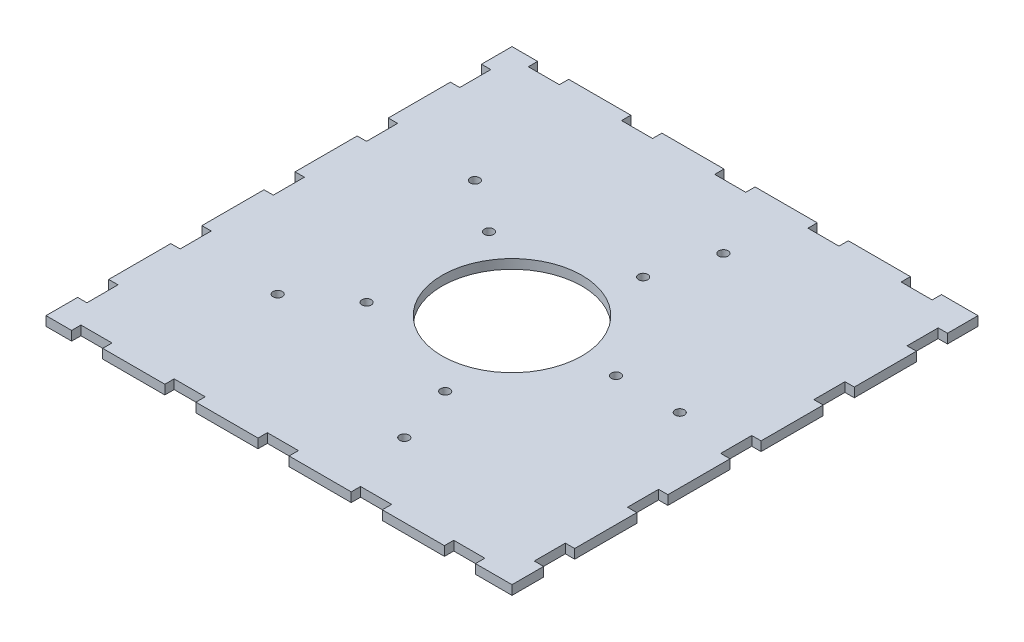
from build123d import *

# Parameters (mm, degrees)
SKETCH1_W           = 150
SKETCH1_H           = 150
BOSS_EXTRUDE1_DEPTH = 3
SKETCH2_R           = 22.5
CUT_EXTRUDE1_DEPTH  = 3
SKETCH3_W           = 10
SKETCH3_H           = 3
CUT_EXTRUDE2_DEPTH  = 3
LPATTERN1_COUNT     = 5
LPATTERN1_PITCH     = 30
SKETCH4_W           = 3
SKETCH4_H           = 10
CUT_EXTRUDE3_DEPTH  = 3
LPATTERN2_COUNT     = 5
LPATTERN2_PITCH     = 30
SKETCH5_R           = 1.5
CUT_EXTRUDE4_DEPTH  = 10


with BuildPart() as part:
    # Sketch1 → Boss-Extrude1 (new body)
    with BuildSketch(Plane(origin=(0, 0, 0), x_dir=(-1, 0, 0), z_dir=(0, 1, 0))):
        Rectangle(SKETCH1_W, SKETCH1_H)
    extrude(amount=BOSS_EXTRUDE1_DEPTH)

    # Sketch2 → Cut-Extrude1 (cut)
    with BuildSketch(Plane(origin=(0, 3, 0), x_dir=(1, 0, 0), z_dir=(0, 1, 0))):
        with Locations(Location((0, 0, 0), (0, 0, 270))):
            Circle(SKETCH2_R)
    extrude(amount=-CUT_EXTRUDE1_DEPTH, mode=Mode.SUBTRACT)

    # Sketch3 → Cut-Extrude2 (cut)
    with BuildSketch(Plane(origin=(0, 3, 0), x_dir=(1, 0, 0), z_dir=(0, 1, 0))):
        with Locations((-61.749963879, 73.5)):
            Rectangle(SKETCH3_W, SKETCH3_H)
        with Locations((-61.749963879, -73.5)):
            Rectangle(SKETCH3_W, SKETCH3_H)
    cut_extrude2 = extrude(amount=-CUT_EXTRUDE2_DEPTH, mode=Mode.SUBTRACT)

    # LPattern1: Cut-Extrude2 ×5
    with Locations(*[(i * LPATTERN1_PITCH, 0, 0) for i in range(1, LPATTERN1_COUNT)]):
        add(cut_extrude2, mode=Mode.SUBTRACT)

    # Sketch4 → Cut-Extrude3 (cut)
    with BuildSketch(Plane(origin=(0, 3, 0), x_dir=(1, 0, 0), z_dir=(0, 1, 0))):
        with Locations((-73.5, -59.825317059)):
            Rectangle(SKETCH4_W, SKETCH4_H)
        with Locations((73.5, -59.825317059)):
            Rectangle(SKETCH4_W, SKETCH4_H)
    cut_extrude3 = extrude(amount=-CUT_EXTRUDE3_DEPTH, mode=Mode.SUBTRACT)

    # LPattern2: Cut-Extrude3 ×5
    with Locations(*[(0, 0, -i * LPATTERN2_PITCH) for i in range(1, LPATTERN2_COUNT)]):
        add(cut_extrude3, mode=Mode.SUBTRACT)

    # Sketch5 → Cut-Extrude4 (cut)
    with BuildSketch(Plane(origin=(0, 0, 0), x_dir=(-1, 0, 0), z_dir=(0, -1, 0))):
        with Locations(Location((-33.5, 0, 0), (0, 0, 180))):
            Circle(SKETCH5_R)
        with Locations(Location((-10.352069312, 31.860393296, 0), (0, 0, 180))):
            Circle(SKETCH5_R)
        with Locations(Location((27.102069312, 19.690805952, 0), (0, 0, 180))):
            Circle(SKETCH5_R)
        with Locations(Location((27.102069312, -19.690805952, 0), (0, 0, 180))):
            Circle(SKETCH5_R)
        with Locations(Location((-10.352069312, -31.860393296, 0), (0, 0, 180))):
            Circle(SKETCH5_R)
        with Locations(Location((-54, 0, 0), (0, 0, 180))):
            Circle(SKETCH5_R)
        with Locations(Location((-16.686917696, 51.35705188, 0), (0, 0, 180))):
            Circle(SKETCH5_R)
        with Locations(Location((43.686917696, 31.740403624, 0), (0, 0, 180))):
            Circle(SKETCH5_R)
        with Locations(Location((43.686917696, -31.740403624, 0), (0, 0, 180))):
            Circle(SKETCH5_R)
        with Locations(Location((-16.686917696, -51.35705188, 0), (0, 0, 180))):
            Circle(SKETCH5_R)
    extrude(amount=-CUT_EXTRUDE4_DEPTH, mode=Mode.SUBTRACT)


solid = part.part
